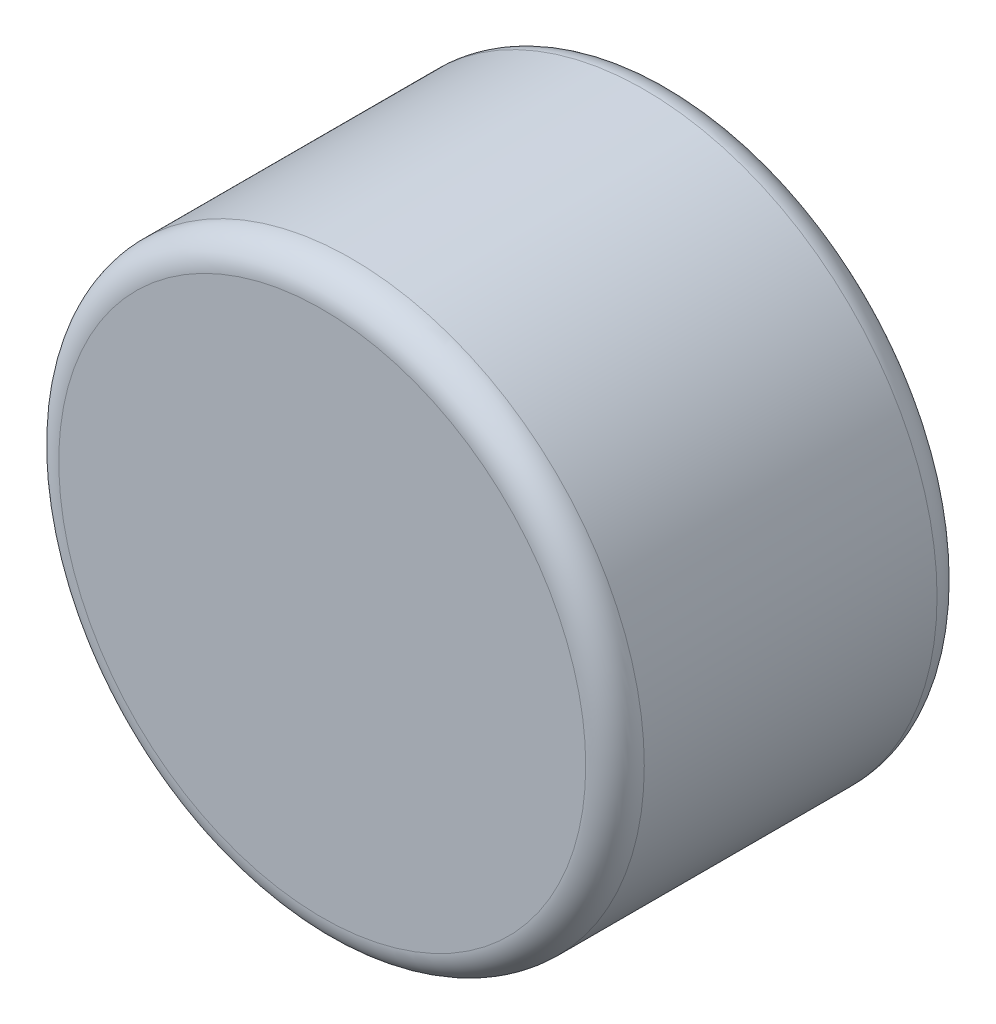
from build123d import *

# Parameters (mm, degrees)
SKETCH_1_R      = 2.5
EXTRUDE_1_DEPTH = 3
FILLET_1_R      = 0.25


with BuildPart() as part:
    # Эскиз1 → Бобышка-Вытянуть1 (new body)
    with BuildSketch(Plane.XY):
        Circle(SKETCH_1_R)
    extrude(amount=EXTRUDE_1_DEPTH)

    # Скругление1
    fillet_1_edges = [part.edges().sort_by_distance(p)[0] for p in [
        (-2.5, 0, 0),
        (-2.5, 0, 3),
    ]]
    fillet(fillet_1_edges, radius=FILLET_1_R)


solid = part.part
